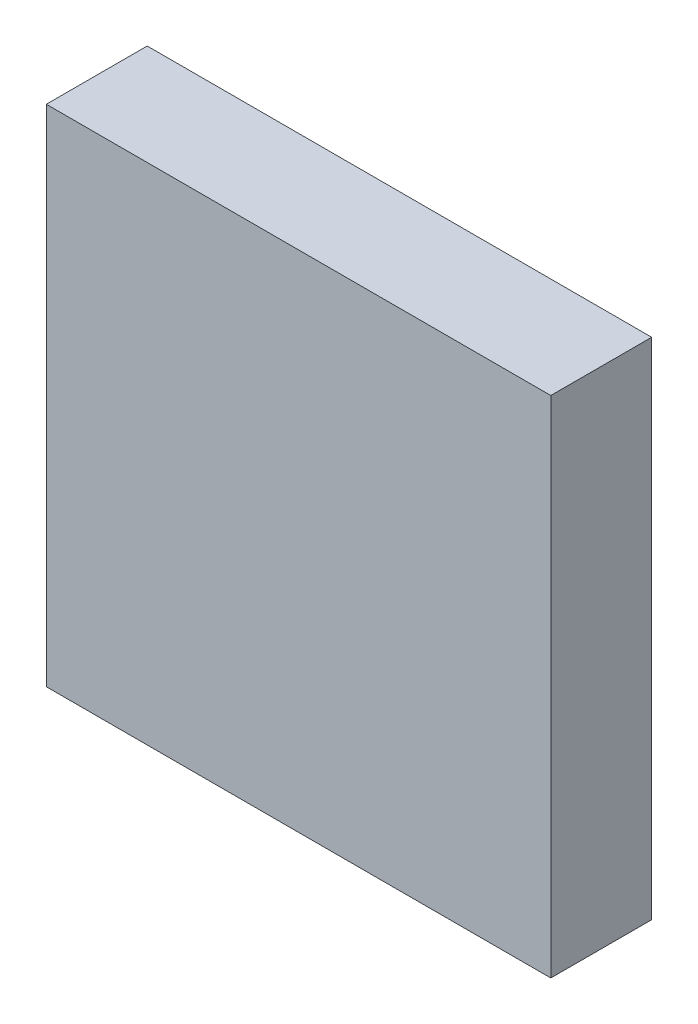
from build123d import *

# Parameters (mm, degrees)
SKETCH1_W           = 1000
SKETCH1_H           = 200
BOSS_EXTRUDE1_DEPTH = 1000


with BuildPart() as part:
    # Sketch1 → Boss-Extrude1 (new body)
    with BuildSketch(Plane(origin=(0, 0, 0), x_dir=(1, 0, 0), z_dir=(0, 1, 0))):
        Rectangle(SKETCH1_W, SKETCH1_H)
    extrude(amount=BOSS_EXTRUDE1_DEPTH)


solid = part.part
